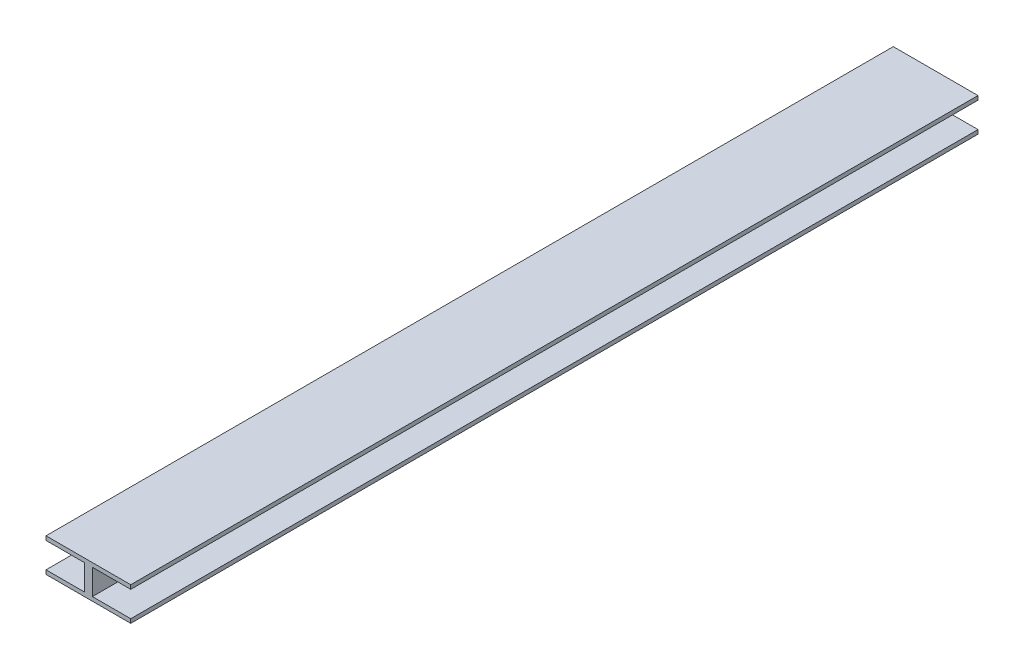
from build123d import *

# Parameters (mm, degrees)
SALIENTE_EXTRUIR1_DEPTH = 500


with BuildPart() as part:
    # Croquis1 → Saliente-Extruir1 (new, symmetric)
    with BuildSketch(Plane.XY):
        Polygon((50, 19.7625), (0, 19.7625), (0, 0), (4.7625, 0), (4.7625, 15), (50, 15), align=None)
        Polygon((4.7625, 0), (0, 0), (0, -19.7625), (50, -19.7625), (50, -15), (4.7625, -15), align=None)
        Polygon((0, 0), (0, 19.7625), (-50, 19.7625), (-50, 15), (-4.7625, 15), (-4.7625, 0), align=None)
        Polygon((0, -19.7625), (0, 0), (-4.7625, 0), (-4.7625, -15), (-50, -15), (-50, -19.7625), align=None)
    extrude(amount=SALIENTE_EXTRUIR1_DEPTH, both=True)


solid = part.part
